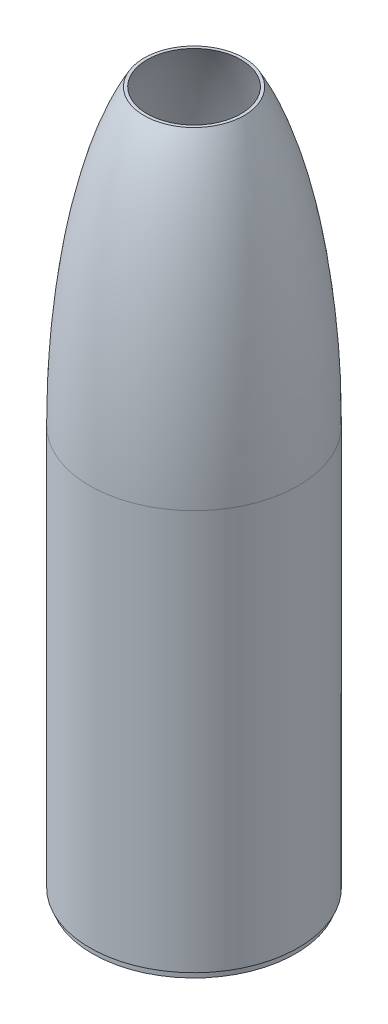
from build123d import *

# Parameters (mm, degrees)
BOSS_EXTRUDE1_START = -304.8
SKETCH2_R           = 76.2
SKETCH2_R_2         = 74.2
BOSS_EXTRUDE1_DEPTH = 304.8
SKETCH3_R           = 102.13398709
CUT_EXTRUDE1_DEPTH  = 30


with BuildPart() as part:
    # Sketch1 → Revolve1 (revolve)
    with BuildSketch(Plane.XY, mode=Mode.PRIVATE) as revolve1_sk:
        with BuildLine():
            Line((76.2, 300), (76.2, 0))
            Line((76.2, 0), (78.16, 0))
            Line((78.16, 0), (78.16, 300))
            add(Edge.make_bspline(
                [(0, 550), (2.723149784, 550), (8.095363208, 549.131102803), (15.985209364, 545.313409978), (23.550682528, 539.130576689), (33.207143777, 527.875372886), (44.403572502, 508.368758892), (56.109342912, 477.087146412), (65.689764926, 439.080732548), (71.61438571, 402.993821619), (74.98797824, 372.299614595), (76.812690029, 348.58573428), (77.914396428, 324.415956203), (78.16, 308.124741441), (78.16, 300)],
                knots=[-1.570796327, -1.570796327, -1.570796327, -1.570796327, -1.472621556, -1.374446786, -1.276272016, -1.178097245, -0.981747704, -0.785398163, -0.589048623, -0.392699082, -0.294524311, -0.196349541, -0.09817477, 0, 0, 0, 0], degree=3))
            Line((0, 550), (0, 548.04))
            add(Edge.make_bspline(
                [(76.2, 300), (76.2, 548.04), (0, 548.04)],
                knots=[1.570796327, 1.570796327, 1.570796327, 3.141592654, 3.141592654, 3.141592654], degree=2, weights=[1, 0.707106781, 1]))
        make_face()
    revolve(revolve1_sk.sketch.rotate(Axis((0, 0, 0), (0, 1, 0)), 90), axis=Axis((0, 0, 0), (0, 1, 0)))

    # Sketch2 → Boss-Extrude1 (add)
    with BuildSketch(Plane(origin=(0, 300, 0), x_dir=(1, 0, 0), z_dir=(0, 1, 0)).offset(BOSS_EXTRUDE1_START)):
        with Locations(Location((0, 0, 0), (0, 0, 270))):
            Circle(SKETCH2_R)
        with Locations(Location((0, 0, 0), (0, 0, 270))):
            Circle(SKETCH2_R_2, mode=Mode.SUBTRACT)
    extrude(amount=BOSS_EXTRUDE1_DEPTH)

    # Sketch3 → Cut-Extrude1 (cut)
    with BuildSketch(Plane(origin=(0, 550, 0), x_dir=(-1, 0, 0), z_dir=(0, -1, 0))):
        Circle(SKETCH3_R)
    extrude(amount=CUT_EXTRUDE1_DEPTH, mode=Mode.SUBTRACT)


solid = part.part
